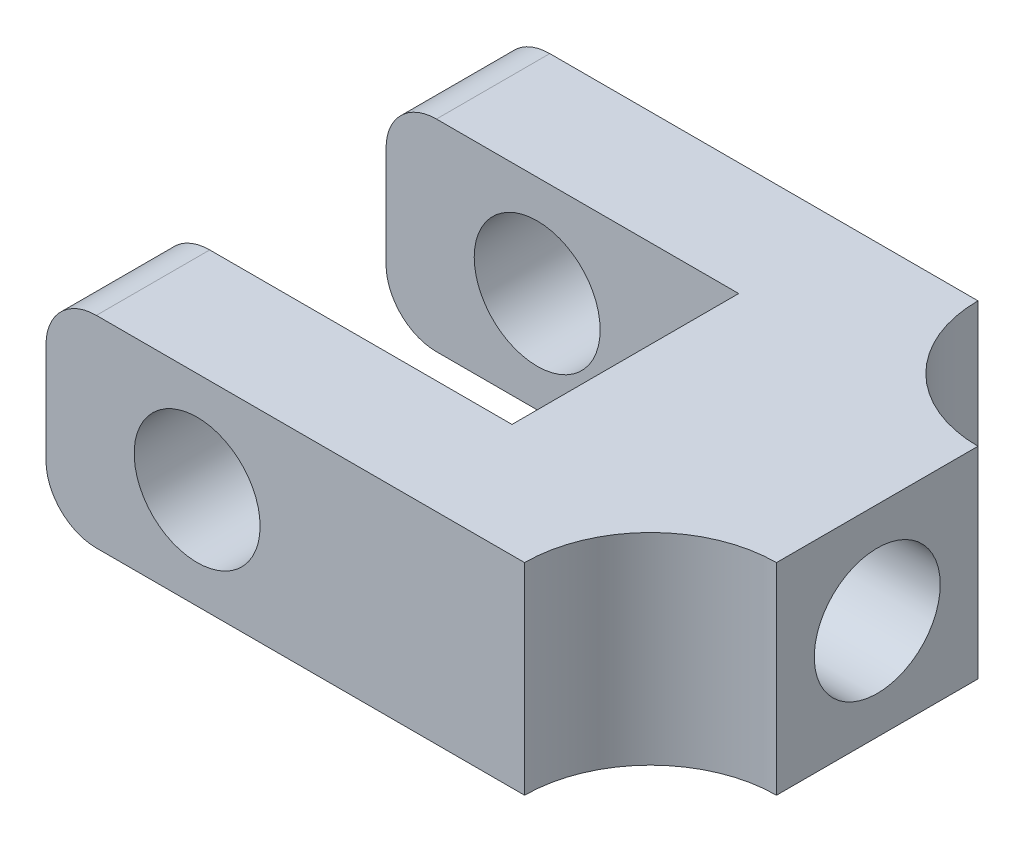
from build123d import *

# Parameters (mm, degrees)
BOSS_EXTRUDE1_DEPTH     = 4
SKETCH3_R               = 2.5
CUT_EXTRUDE1_DEPTH      = 26.942243542
CUT_EXTRUDE2_DEPTH      = 18.117242769
CUT_EXTRUDE2_DEPTH_BACK = 18.117242769
SKETCH4_R               = 2.5
FILLET1_R               = 2


with BuildPart() as part:
    # Sketch2 → Boss-Extrude1 (new, symmetric)
    with BuildSketch(Plane(origin=(0, 0, 0), x_dir=(1, 0, 0), z_dir=(0, 1, 0))):
        with BuildLine():
            Line((0, 4.5), (-14, 4.5))
            Line((-14, 4.5), (-14, 9))
            Line((-14, 9), (5, 9))
            ThreePointArc((5, 9), (6.464466094, 5.464466094), (10, 4))
            Line((10, 4), (10, -4))
            ThreePointArc((10, -4), (6.464466094, -5.464466094), (5, -9))
            Line((5, -9), (-14, -9))
            Line((-14, -9), (-14, -4.5))
            Line((-14, -4.5), (0, -4.5))
            Line((0, -4.5), (0, 4.5))
        make_face()
    extrude(amount=BOSS_EXTRUDE1_DEPTH, both=True)

    # Sketch3 → Cut-Extrude1 (cut, through all)
    with BuildSketch(Plane(origin=(10, 0, 0), x_dir=(0, 0, -1), z_dir=(1, 0, 0))):
        Circle(SKETCH3_R)
    extrude(amount=-CUT_EXTRUDE1_DEPTH, mode=Mode.SUBTRACT)

    # Sketch4 → Cut-Extrude2 (cut, two sides: drawn at the far end of the back side and taken through both)
    with BuildSketch(Plane.XY.offset(-CUT_EXTRUDE2_DEPTH_BACK)):
        with Locations((-8, 0)):
            Circle(SKETCH4_R)
    extrude(amount=CUT_EXTRUDE2_DEPTH + CUT_EXTRUDE2_DEPTH_BACK, mode=Mode.SUBTRACT)

    # Fillet1
    fillet1_edges = [part.edges().sort_by_distance(p)[0] for p in [
        (-14, -4, -6.75),
        (-14, 4, 6.75),
        (-14, -4, 6.75),
        (-14, 4, -6.75),
    ]]
    fillet(fillet1_edges, radius=FILLET1_R)


solid = part.part
